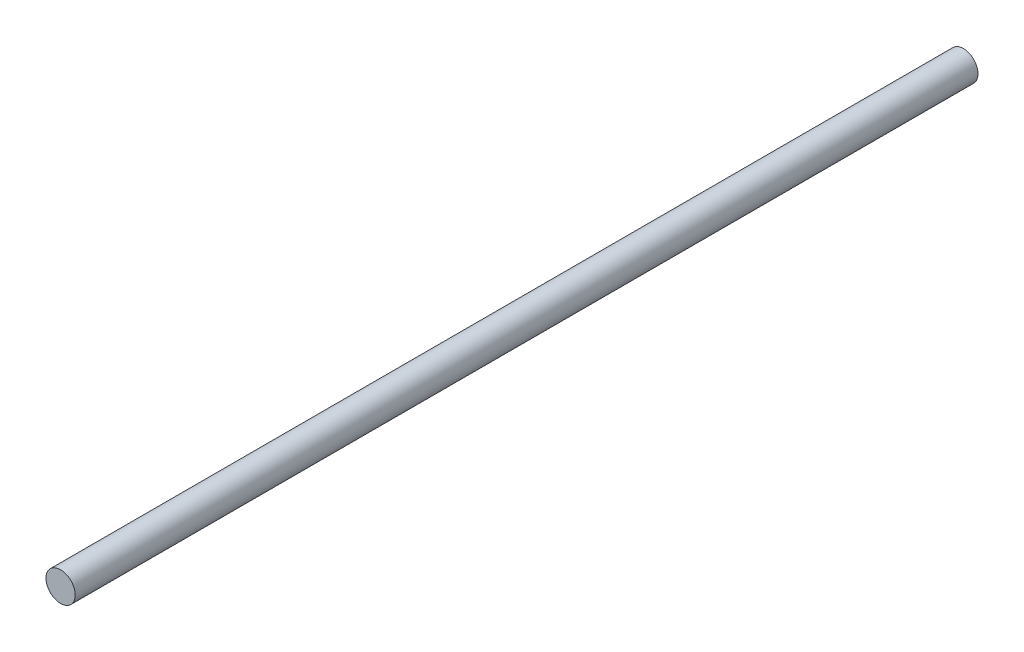
from build123d import *

# Parameters (mm, degrees)
SKETCH1_R           = 3.175
BOSS_EXTRUDE1_DEPTH = 196


with BuildPart() as part:
    # Sketch1 → Boss-Extrude1 (new body)
    with BuildSketch(Plane.XY):
        Circle(SKETCH1_R)
    extrude(amount=BOSS_EXTRUDE1_DEPTH)


solid = part.part
